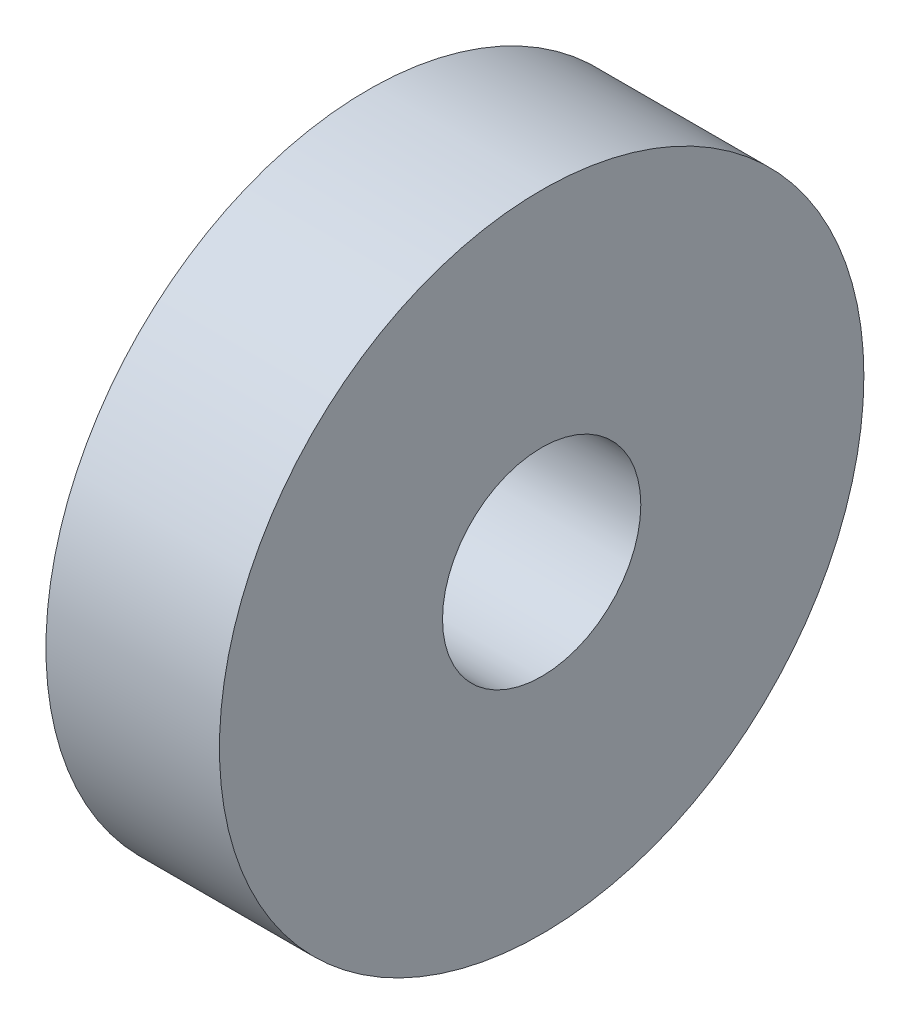
from build123d import *

# Parameters (mm, degrees)
SKETCH_1_R      = 13
SKETCH_1_R_2    = 4
EXTRUDE_1_DEPTH = 7


with BuildPart() as part:
    # Эскиз1 → Вытянуть1 (new body)
    with BuildSketch(Plane(origin=(0, 0, 0), x_dir=(0, 0, -1), z_dir=(1, 0, 0))):
        Circle(SKETCH_1_R)
        Circle(SKETCH_1_R_2, mode=Mode.SUBTRACT)
    extrude(amount=-EXTRUDE_1_DEPTH)


solid = part.part
